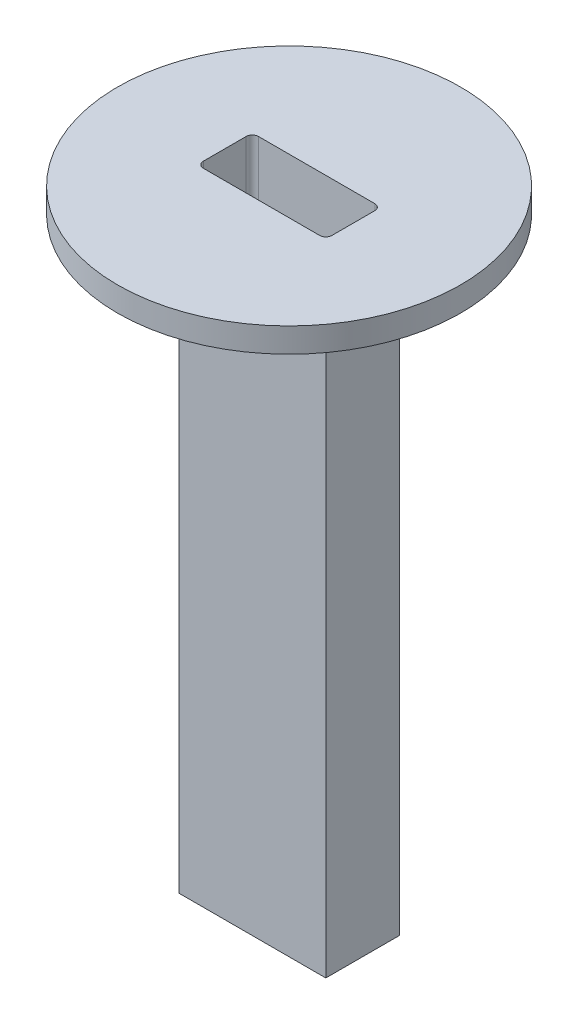
from build123d import *

# Parameters (mm, degrees)
SKETCH1_R           = 88.9
BOSS_EXTRUDE1_DEPTH = 12.7
SKETCH2_W           = 76.2
SKETCH2_H           = 38.1
BOSS_EXTRUDE2_DEPTH = 314.325
CUT_EXTRUDE1_DEPTH  = 317.5


with BuildPart() as part:
    # Sketch1 → Boss-Extrude1 (new body)
    with BuildSketch(Plane(origin=(0, 0, 0), x_dir=(1, 0, 0), z_dir=(0, 1, 0))):
        with Locations(Location((0, 0, 0), (0, 0, 270))):
            Circle(SKETCH1_R)
    extrude(amount=BOSS_EXTRUDE1_DEPTH)

    # Sketch2 → Boss-Extrude2 (add)
    with BuildSketch(Plane.XZ):
        Rectangle(SKETCH2_W, SKETCH2_H)
    extrude(amount=BOSS_EXTRUDE2_DEPTH)

    # Sketch3 → Cut-Extrude1 (cut)
    with BuildSketch(Plane(origin=(0, 12.7, 0), x_dir=(1, 0, 0), z_dir=(0, 1, 0))):
        with BuildLine():
            Line((-30.1625, 14.2875), (30.1625, 14.2875))
            ThreePointArc((30.1625, 14.2875), (32.40756403, 13.35756403), (33.3375, 11.1125))
            Line((33.3375, 11.1125), (33.3375, -11.1125))
            ThreePointArc((33.3375, -11.1125), (32.40756403, -13.35756403), (30.1625, -14.2875))
            Line((30.1625, -14.2875), (-30.1625, -14.2875))
            ThreePointArc((-30.1625, -14.2875), (-32.40756403, -13.35756403), (-33.3375, -11.1125))
            Line((-33.3375, -11.1125), (-33.3375, 11.1125))
            ThreePointArc((-33.3375, 11.1125), (-32.40756403, 13.35756403), (-30.1625, 14.2875))
        make_face()
    extrude(amount=-CUT_EXTRUDE1_DEPTH, mode=Mode.SUBTRACT)


solid = part.part
